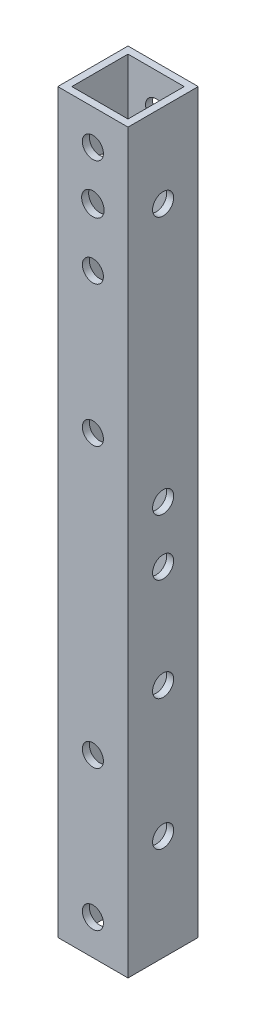
from build123d import *

# Parameters (mm, degrees)
SKETCH_1_W          = 10
SKETCH_1_H          = 10
SKETCH_1_W_2        = 8
SKETCH_1_H_2        = 8
EXTRUDE_1_DEPTH     = 104.9
SKETCH_2_R          = 1.5
SKETCH_2_R_2        = 1.6
CUT_EXTRUDE_1_DEPTH = 106.494123059
SKETCH_3_R          = 1.5
CUT_EXTRUDE_2_DEPTH = 106.494123059


with BuildPart() as part:
    # ｽｹｯﾁ1 → 押し出し-薄板1 (new body)
    with BuildSketch(Plane(origin=(0, 0, 0), x_dir=(1, 0, 0), z_dir=(0, 1, 0))):
        Rectangle(SKETCH_1_W, SKETCH_1_H)
        Rectangle(SKETCH_1_W_2, SKETCH_1_H_2, mode=Mode.SUBTRACT)
    extrude(amount=EXTRUDE_1_DEPTH)

    # ｽｹｯﾁ2 → ｶｯﾄ - 押し出し1 (cut, through all)
    with BuildSketch(Plane.XY.offset(5)):
        with Locations((0, 5)):
            Circle(SKETCH_2_R)
        with Locations((0, 64.7)):
            Circle(SKETCH_2_R)
        with Locations((0, 99.9)):
            Circle(SKETCH_2_R)
        with Locations((0, 84.7)):
            Circle(SKETCH_2_R)
        with Locations((0, 25)):
            Circle(SKETCH_2_R)
        with Locations((0, 92.95)):
            Circle(SKETCH_2_R_2)
    extrude(amount=-CUT_EXTRUDE_1_DEPTH, mode=Mode.SUBTRACT)

    # ｽｹｯﾁ3 → ｶｯﾄ - 押し出し2 (cut, through all)
    with BuildSketch(Plane(origin=(5, 0, 0), x_dir=(0, 0, -1), z_dir=(1, 0, 0))):
        with Locations((0, 33.6)):
            Circle(SKETCH_3_R)
        with Locations((0, 15)):
            Circle(SKETCH_3_R)
        with Locations((0, 48.2)):
            Circle(SKETCH_3_R)
        with Locations((0, 56.2)):
            Circle(SKETCH_3_R)
        with Locations((0, 92.95)):
            Circle(SKETCH_3_R)
    extrude(amount=-CUT_EXTRUDE_2_DEPTH, mode=Mode.SUBTRACT)


solid = part.part
